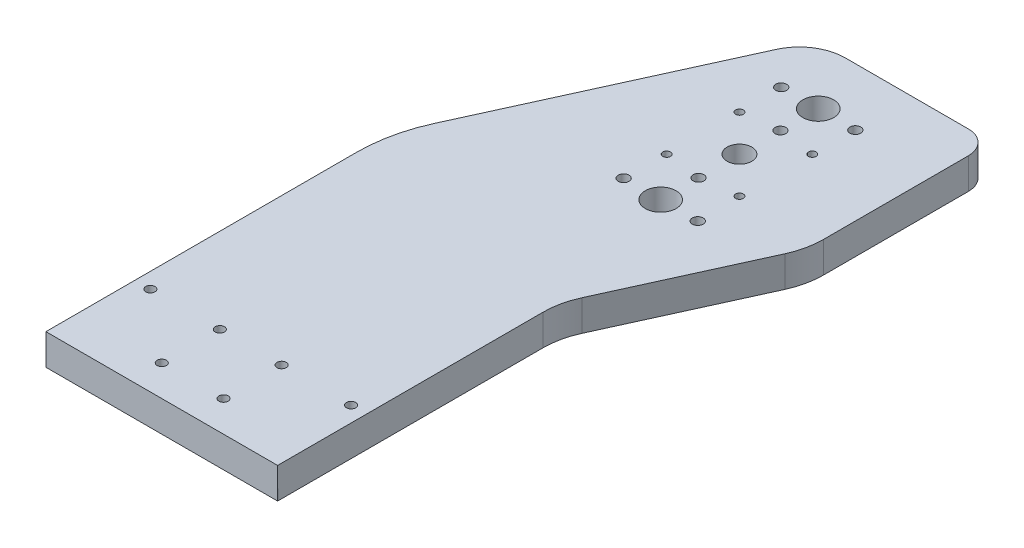
from build123d import *
from build123d.topology import SkipClean

# Parameters (mm, degrees)
BOSS_EXTRUDE1_DEPTH = 20
FILLET1_R           = 15
FILLET3_R           = 30
FILLET4_R           = 100
CUT_EXTRUDE1_DEPTH  = 20
FILLET6_R           = 50
FILLET7_R           = 50
FILLET9_R           = 0.1
FILLET10_R          = 0.1
SKETCH3_R           = 3
CUT_EXTRUDE2_DEPTH  = 13
SKETCH4_R           = 8
SKETCH4_R_2         = 10
CUT_EXTRUDE3_DEPTH  = 30
SKETCH5_R           = 3.5
CUT_EXTRUDE4_DEPTH  = 13
SKETCH6_R           = 3.5
CUT_EXTRUDE5_DEPTH  = 13
SKETCH7_R           = 3
BOSS_EXTRUDE2_DEPTH = 13
SKETCH8_R           = 3
BOSS_EXTRUDE3_DEPTH = 13
SKETCH9_R           = 3.5
CUT_EXTRUDE6_DEPTH  = 13
SKETCH10_R          = 3.5
BOSS_EXTRUDE4_DEPTH = 13
SKETCH11_R          = 3.5
CUT_EXTRUDE7_DEPTH  = 13
SKETCH12_R          = 3.5
BOSS_EXTRUDE5_DEPTH = 13
SKETCH14_R          = 2.5
CUT_EXTRUDE8_DEPTH  = 13
SKETCH16_W          = 150
SKETCH16_H          = 20
CUT_EXTRUDE9_DEPTH  = 70
SKETCH17_R          = 3
CUT_EXTRUDE10_DEPTH = 70
SKETCH18_R          = 3.5
SKETCH18_R_2        = 2.5
SKETCH18_R_3        = 8
SKETCH18_R_4        = 10
CUT_EXTRUDE11_DEPTH = 70
BOSS_EXTRUDE6_START = -7
BOSS_EXTRUDE6_DEPTH = 7
BOSS_EXTRUDE7_DEPTH = 20
FILLET11_R          = 30
FILLET13_R          = 15
BOSS_EXTRUDE8_START = -20
BOSS_EXTRUDE8_DEPTH = 20
FILLET14_R          = 30
FILLET15_R          = 15


with BuildPart() as part:
    # Sketch1 → Boss-Extrude1 (new body)
    with BuildSketch(Plane(origin=(0, 0, 0), x_dir=(1, 0, 0), z_dir=(0, 1, 0))):
        Polygon((0, 0), (150, 0), (150, 150), (200, 260), (200, 400), (80.578675248, 400), (0, 222.694428273), align=None)
    extrude(amount=BOSS_EXTRUDE1_DEPTH)

    # Fillet1
    fillet1_edges = [part.edges().sort_by_distance(p)[0] for p in [
        (200, 10, -400),
    ]]
    fillet(fillet1_edges, radius=FILLET1_R)

    # Fillet3
    fillet3_edges = [part.edges().sort_by_distance(p)[0] for p in [
        (80.578675248, 10, -400),
    ]]
    fillet(fillet3_edges, radius=FILLET3_R)

    # Fillet4
    fillet4_edges = [part.edges().sort_by_distance(p)[0] for p in [
        (0, 10, -222.694428273),
    ]]
    fillet(fillet4_edges, radius=FILLET4_R)

    # Sketch2 → Cut-Extrude1 (cut)
    with BuildSketch(Plane(origin=(0, 20, 0), x_dir=(1, 0, 0), z_dir=(0, 1, 0))):
        Polygon((150, 150), (150, 173.876585238), (150, 182.670606049), (200, 292.6907641), (200, 260), align=None)
    extrude(amount=-CUT_EXTRUDE1_DEPTH, mode=Mode.SUBTRACT)

    # Fillet6
    fillet6_edges = [part.edges().sort_by_distance(p)[0] for p in [
        (200, 10, -292.6907641),
    ]]
    fillet(fillet6_edges, radius=FILLET6_R)

    # Fillet7
    fillet7_edges = [part.edges().sort_by_distance(p)[0] for p in [
        (150, 10, -182.670606049),
    ]]
    fillet(fillet7_edges, radius=FILLET7_R)

    # Fillet9
    fillet9_edges = [part.edges().sort_by_distance(p)[0] for p in [
        (0, 10, 0),
    ]]
    fillet(fillet9_edges, radius=FILLET9_R)

    # Fillet10
    fillet10_edges = [part.edges().sort_by_distance(p)[0] for p in [
        (150, 10, 0),
    ]]
    fillet(fillet10_edges, radius=FILLET10_R)

    # Sketch3 → Cut-Extrude2 (cut)
    with BuildSketch(Plane(origin=(0, 20, 0), x_dir=(1, 0, 0), z_dir=(0, 1, 0))):
        with Locations((55, 57.83)):
            Circle(SKETCH3_R)
        with Locations((10, 57.83)):
            Circle(SKETCH3_R)
        with Locations((140, 57.83)):
            Circle(SKETCH3_R)
        with Locations((95, 57.83)):
            Circle(SKETCH3_R)
        with Locations((95, 20)):
            Circle(SKETCH3_R)
        with Locations((55, 20)):
            Circle(SKETCH3_R)
    extrude(amount=-CUT_EXTRUDE2_DEPTH, mode=Mode.SUBTRACT)

    # Sketch4 → Cut-Extrude3 (cut)
    with BuildSketch(Plane(origin=(0, 20, 0), x_dir=(1, 0, 0), z_dir=(0, 1, 0))):
        with Locations((125, 330)):
            Circle(SKETCH4_R)
        with Locations((125, 375)):
            Circle(SKETCH4_R_2)
        with Locations((125, 285)):
            Circle(SKETCH4_R_2)
    extrude(amount=-CUT_EXTRUDE3_DEPTH, mode=Mode.SUBTRACT)

    # Sketch5 → Cut-Extrude4 (cut)
    with BuildSketch(Plane(origin=(0, 20, 0), x_dir=(1, 0, 0), z_dir=(0, 1, 0))):
        with Locations((149, 375)):
            Circle(SKETCH5_R)
        with Locations((101, 375)):
            Circle(SKETCH5_R)
        with Locations((149, 285)):
            Circle(SKETCH5_R)
        with Locations((101, 285)):
            Circle(SKETCH5_R)
    extrude(amount=-CUT_EXTRUDE4_DEPTH, mode=Mode.SUBTRACT)

    # Sketch6 → Cut-Extrude5 (cut)
    with BuildSketch(Plane(origin=(0, 20, 0), x_dir=(1, 0, 0), z_dir=(0, 1, 0))):
        with Locations((151.5, 330)):
            Circle(SKETCH6_R)
        with Locations((98.5, 330)):
            Circle(SKETCH6_R)
    extrude(amount=-CUT_EXTRUDE5_DEPTH, mode=Mode.SUBTRACT)

    # Sketch7 → Boss-Extrude2 (add)
    with BuildSketch(Plane(origin=(0, 20, 0), x_dir=(1, 0, 0), z_dir=(0, 1, 0))):
        with BuildLine():
            Line((149.9, 0), (0.1, 0))
            Line((0.1, 0), (0.1, -70))
            Line((0.1, -70), (39.581431097, -70))
            Line((39.581431097, -70), (55.1, -70))
            Line((55.1, -70), (150, -70))
            Line((150, -70), (150, 0.1))
            ThreePointArc((150, 0.1), (149.970710678, 0.029289322), (149.9, 0))
        make_face()
        with BuildLine():
            ThreePointArc((58.1, -50), (57.221320344, -52.121320344), (55.1, -53))
            ThreePointArc((55.1, -53), (52.1, -50), (55.1, -47))
            ThreePointArc((55.1, -47), (57.221320344, -47.878679656), (58.1, -50))
        make_face(mode=Mode.SUBTRACT)
        with BuildLine():
            ThreePointArc((98.1, -50), (92.978679656, -52.121320344), (95.1, -47))
            ThreePointArc((95.1, -47), (97.221320344, -47.878679656), (98.1, -50))
        make_face(mode=Mode.SUBTRACT)
        with Locations((10.1, -12.17)):
            Circle(SKETCH7_R, mode=Mode.SUBTRACT)
        with BuildLine():
            ThreePointArc((58.1, -12.17), (57.221320344, -14.291320344), (55.1, -15.17))
            ThreePointArc((55.1, -15.17), (52.978679656, -14.291320344), (52.1, -12.17))
            ThreePointArc((52.1, -12.17), (55.1, -9.17), (58.1, -12.17))
        make_face(mode=Mode.SUBTRACT)
        with BuildLine():
            ThreePointArc((95.1, -15.17), (92.978679656, -14.291320344), (92.1, -12.17))
            ThreePointArc((92.1, -12.17), (95.1, -9.17), (98.1, -12.17))
            ThreePointArc((98.1, -12.17), (97.221320344, -14.291320344), (95.1, -15.17))
        make_face(mode=Mode.SUBTRACT)
        with BuildLine():
            ThreePointArc((143.1, -12.17), (140.1, -15.17), (137.1, -12.17))
            ThreePointArc((137.1, -12.17), (140.1, -9.17), (143.1, -12.17))
        make_face(mode=Mode.SUBTRACT)
    extrude(amount=-BOSS_EXTRUDE2_DEPTH)

    # Sketch8 → Boss-Extrude3 (add)
    with BuildSketch(Plane(origin=(0, 20, 0), x_dir=(1, 0, 0), z_dir=(0, 1, 0))):
        with Locations((10, 57.83)):
            Circle(SKETCH8_R)
        with Locations((55, 57.83)):
            Circle(SKETCH8_R)
        with Locations((95, 57.83)):
            Circle(SKETCH8_R)
        with Locations((140, 57.83)):
            Circle(SKETCH8_R)
        with Locations((95, 20)):
            Circle(SKETCH8_R)
        with Locations((55, 20)):
            Circle(SKETCH8_R)
    extrude(amount=-BOSS_EXTRUDE3_DEPTH)

    # Sketch9 → Cut-Extrude6 (cut)
    with BuildSketch(Plane(origin=(0, 20, 0), x_dir=(1, 0, 0), z_dir=(0, 1, 0))):
        with BuildLine():
            ThreePointArc((133, 279), (129.472135955, 276.05572809), (125, 275))
            ThreePointArc((125, 275), (120.527864045, 276.05572809), (117, 279))
            ThreePointArc((117, 279), (125, 263), (133, 279))
        make_face()
        with BuildLine():
            ThreePointArc((117.583801513, 327), (125, 316), (132.416198487, 327))
            ThreePointArc((132.416198487, 327), (125, 322), (117.583801513, 327))
        make_face()
        with BuildLine():
            ThreePointArc((96.697224362, 327), (98.5, 320.5), (100.302775638, 327))
            ThreePointArc((100.302775638, 327), (98.5, 326.5), (96.697224362, 327))
        make_face()
        with BuildLine():
            ThreePointArc((149.697224362, 327), (151.5, 320.5), (153.302775638, 327))
            ThreePointArc((153.302775638, 327), (151.5, 326.5), (149.697224362, 327))
        make_face()
        with Locations((101, 273)):
            Circle(SKETCH9_R)
        with Locations((149, 273)):
            Circle(SKETCH9_R)
    extrude(amount=-CUT_EXTRUDE6_DEPTH, mode=Mode.SUBTRACT)

    # Sketch10 → Boss-Extrude4 (add)
    with SkipClean():  # the faces are left unmerged after this step: merging them gives an invalid solid
        with BuildSketch(Plane(origin=(0, 20, 0), x_dir=(1, 0, 0), z_dir=(0, 1, 0))):
            with BuildLine():
                ThreePointArc((117.583801513, 327), (125, 332), (132.416198487, 327))
                ThreePointArc((132.416198487, 327), (125, 338), (117.583801513, 327))
            make_face()
            with BuildLine():
                ThreePointArc((149.697224362, 327), (151.5, 327.5), (153.302775638, 327))
                ThreePointArc((153.302775638, 327), (151.5, 333.5), (149.697224362, 327))
            make_face()
            with BuildLine():
                ThreePointArc((100.302775638, 327), (98.5, 333.5), (96.697224362, 327))
                ThreePointArc((96.697224362, 327), (98.5, 327.5), (100.302775638, 327))
            make_face()
            with BuildLine():
                ThreePointArc((133, 279), (125, 295), (117, 279))
                ThreePointArc((117, 279), (125, 283), (133, 279))
            make_face()
            with Locations((149, 285)):
                Circle(SKETCH10_R)
            with Locations((101, 285)):
                Circle(SKETCH10_R)
        extrude(amount=-BOSS_EXTRUDE4_DEPTH)

    # Sketch11 → Cut-Extrude7 (cut)
    with SkipClean():  # the faces are left unmerged after this step: merging them gives an invalid solid
        with BuildSketch(Plane(origin=(0, 20, 0), x_dir=(1, 0, 0), z_dir=(0, 1, 0))):
            with Locations((125, 350.5)):
                Circle(SKETCH11_R)
            with Locations((125, 297.5)):
                Circle(SKETCH11_R)
        extrude(amount=-CUT_EXTRUDE7_DEPTH, mode=Mode.SUBTRACT)

    # Sketch12 → Boss-Extrude5 (add)
    with SkipClean():  # the faces are left unmerged after this step: merging them gives an invalid solid
        with BuildSketch(Plane(origin=(0, 20, 0), x_dir=(1, 0, 0), z_dir=(0, 1, 0))):
            with Locations((151.5, 324)):
                Circle(SKETCH12_R)
            with Locations((98.5, 324)):
                Circle(SKETCH12_R)
        extrude(amount=-BOSS_EXTRUDE5_DEPTH)

    # Sketch14 → Cut-Extrude8 (cut)
    with SkipClean():  # the faces are left unmerged after this step: merging them gives an invalid solid
        with BuildSketch(Plane(origin=(0, 20, 0), x_dir=(1, 0, 0), z_dir=(0, 1, 0))):
            with Locations((148.57, 347.57)):
                Circle(SKETCH14_R)
            with Locations((148.57, 300.43)):
                Circle(SKETCH14_R)
            with Locations((101.43, 300.43)):
                Circle(SKETCH14_R)
            with Locations((101.43, 347.57)):
                Circle(SKETCH14_R)
        extrude(amount=-CUT_EXTRUDE8_DEPTH, mode=Mode.SUBTRACT)

    # Sketch16 → Cut-Extrude9 (cut)
    with SkipClean():  # the faces are left unmerged after this step: merging them gives an invalid solid
        with BuildSketch(Plane.XY.offset(70)):
            with Locations((75, 10)):
                Rectangle(SKETCH16_W, SKETCH16_H)
        extrude(amount=-CUT_EXTRUDE9_DEPTH, mode=Mode.SUBTRACT)

    # Sketch17 → Cut-Extrude10 (cut)
    with SkipClean():  # the faces are left unmerged after this step: merging them gives an invalid solid
        with BuildSketch(Plane(origin=(0, 20, 0), x_dir=(1, 0, 0), z_dir=(0, 1, 0))):
            with Locations((10, 57.58)):
                Circle(SKETCH17_R)
            with Locations((55, 57.58)):
                Circle(SKETCH17_R)
            with Locations((55, 20)):
                Circle(SKETCH17_R)
            with Locations((95, 20)):
                Circle(SKETCH17_R)
            with Locations((95, 57.58)):
                Circle(SKETCH17_R)
            with Locations((140, 57.58)):
                Circle(SKETCH17_R)
        extrude(amount=-CUT_EXTRUDE10_DEPTH, mode=Mode.SUBTRACT)

    # Sketch18 → Cut-Extrude11 (cut)
    with SkipClean():  # the faces are left unmerged after this step: merging them gives an invalid solid
        with BuildSketch(Plane(origin=(0, 20, 0), x_dir=(1, 0, 0), z_dir=(0, 1, 0))):
            with Locations((149, 375)):
                Circle(SKETCH18_R)
            with Locations((148.57, 347.57)):
                Circle(SKETCH18_R_2)
            with Locations((125, 350.5)):
                Circle(SKETCH18_R)
            with Locations((101, 375)):
                Circle(SKETCH18_R)
            with Locations((101.43, 347.57)):
                Circle(SKETCH18_R_2)
            with Locations((125, 324)):
                Circle(SKETCH18_R_3)
            with Locations((148.57, 300.43)):
                Circle(SKETCH18_R_2)
            with Locations((125, 297.5)):
                Circle(SKETCH18_R)
            with Locations((101.43, 300.43)):
                Circle(SKETCH18_R_2)
            with Locations((125, 273)):
                Circle(SKETCH18_R_4)
            with Locations((149, 273)):
                Circle(SKETCH18_R)
            with Locations((101, 273)):
                Circle(SKETCH18_R)
        extrude(amount=-CUT_EXTRUDE11_DEPTH, mode=Mode.SUBTRACT)

    # Sketch19 → Boss-Extrude6 (add)
    with BuildSketch(Plane.XZ.offset(BOSS_EXTRUDE6_START)):
        with BuildLine():
            ThreePointArc((117, -279), (125, -295), (133, -279))
            ThreePointArc((133, -279), (125, -283), (117, -279))
        make_face()
        with BuildLine():
            ThreePointArc((132.416198487, -327), (125, -332), (117.583801513, -327))
            ThreePointArc((117.583801513, -327), (125, -338), (132.416198487, -327))
        make_face()
    extrude(amount=BOSS_EXTRUDE6_DEPTH)

    # Sketch20 → Boss-Extrude7 (add)
    with BuildSketch(Plane(origin=(0, 20, 0), x_dir=(1, 0, 0), z_dir=(0, 1, 0))):
        with BuildLine():
            Line((99.897538035, 400), (185, 400))
            ThreePointArc((185, 400), (195.606601718, 395.606601718), (200, 385))
            Line((200, 385), (200, 402.25))
            Line((200, 402.25), (81.601215135, 402.25))
            Line((81.601215135, 402.25), (72.585686906, 382.412203187))
            ThreePointArc((72.585686906, 382.412203187), (83.655095109, 395.222669324), (99.897538035, 400))
        make_face()
    extrude(amount=-BOSS_EXTRUDE7_DEPTH)

    # Fillet11
    fillet11_edges = [part.edges().sort_by_distance(p)[0] for p in [
        (81.601215135, 10, -402.25),
    ]]
    fillet(fillet11_edges, radius=FILLET11_R)

    # Fillet13
    fillet13_edges = [part.edges().sort_by_distance(p)[0] for p in [
        (200, 10, -402.25),
    ]]
    fillet(fillet13_edges, radius=FILLET13_R)

    # Sketch21 → Boss-Extrude8 (add)
    with BuildSketch(Plane(origin=(0, 20, 0), x_dir=(1, 0, 0), z_dir=(0, 1, 0)).offset(BOSS_EXTRUDE8_START)):
        with BuildLine():
            Line((100.920077922, 402.25), (185, 402.25))
            ThreePointArc((185, 402.25), (195.606601718, 397.856601718), (200, 387.25))
            Line((200, 387.25), (200, 412.25))
            Line((200, 412.25), (86.145836856, 412.25))
            Line((86.145836856, 412.25), (73.608226794, 384.662203187))
            ThreePointArc((73.608226794, 384.662203187), (84.677634996, 397.472669324), (100.920077922, 402.25))
        make_face()
    extrude(amount=BOSS_EXTRUDE8_DEPTH)

    # Fillet14
    fillet14_edges = [part.edges().sort_by_distance(p)[0] for p in [
        (86.145836856, 10, -412.25),
    ]]
    fillet(fillet14_edges, radius=FILLET14_R)

    # Fillet15
    fillet15_edges = [part.edges().sort_by_distance(p)[0] for p in [
        (200, 10, -412.25),
    ]]
    fillet(fillet15_edges, radius=FILLET15_R)


solid = part.part
